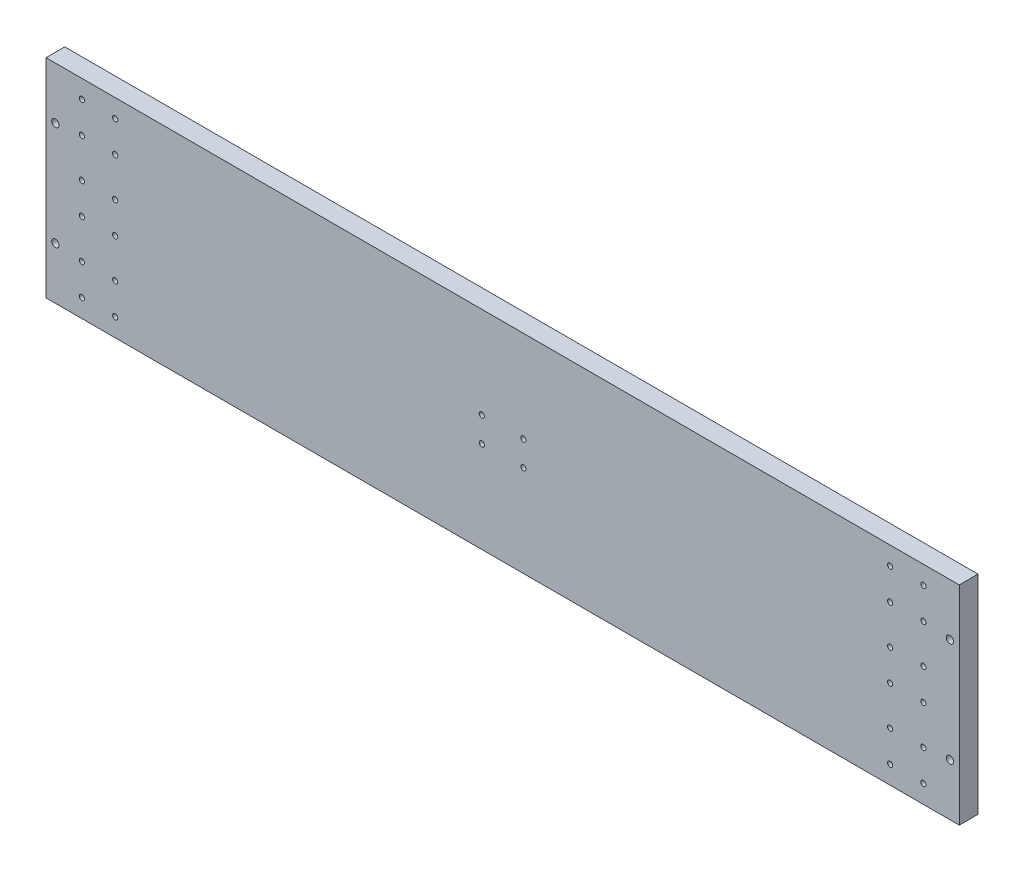
from build123d import *

# Parameters (mm, degrees)
SKETCH1_W             = 878
SKETCH1_H             = 200
BOSS_EXTRUDE1_DEPTH   = 18
OTW_R_7_0_7_1_D       = 7
OTW_R_5_0_5_1_D       = 5
OTW_R_10_0_10_1_D     = 10
OTW_R_10_0_10_1_DEPTH = 7
OTW_R_5_0_5_2_D       = 5
OTW_R_10_0_10_2_D     = 10
OTW_R_10_0_10_2_DEPTH = 7
OTW_R_8_0_8_1_D       = 8
OTW_R_8_0_8_1_DEPTH   = 15
OTW_R_8_0_8_1_TIP     = 2.403442476


with BuildPart() as part:
    # Sketch1 → Boss-Extrude1 (new body)
    with BuildSketch(Plane.XY):
        Rectangle(SKETCH1_W, SKETCH1_H)
    extrude(amount=BOSS_EXTRUDE1_DEPTH)

    # Otwór Ø7.0 (7)1 (through all)
    with Locations(Plane(origin=(0, 0, 0), x_dir=(-1, 0, 0), z_dir=(0, 0, -1))):
        with Locations((-430, 50), (-430, -50)):
            otw_r_7_0_7_1 = Hole(OTW_R_7_0_7_1_D / 2)

    # Lustro1: Otwór Ø7.0 (7)1 across plane
    add(otw_r_7_0_7_1.mirror(Plane.ZY), mode=Mode.SUBTRACT)

    # Otwór Ø5.0 (5)1 (through all)
    with Locations(Plane.XY.offset(18)):
        with Locations((372.5, 82.5), (372.5, 52.5), (404.5, 82.5), (404.5, 52.5), (404.5, 15), (404.5, -15), (372.5, 15), (372.5, -15), (372.5, -52.5), (372.5, -82.5), (404.5, -52.5), (404.5, -82.5), (-372.5, 82.5), (-372.5, 52.5), (-404.5, 52.5), (-404.5, 82.5), (-372.5, 15), (-372.5, -15), (-404.5, -15), (-404.5, 15), (-372.5, -82.5), (-372.5, -52.5), (-404.5, -52.5), (-404.5, -82.5)):
            Hole(OTW_R_5_0_5_1_D / 2)

    # Otwór Ø10.0 (10)1
    with Locations(Plane(origin=(0, 0, 0), x_dir=(-1, 0, 0), z_dir=(0, 0, -1))):
        with Locations((372.5, 82.5), (372.5, 52.5), (372.5, 15), (372.5, -15), (372.5, -52.5), (372.5, -82.5), (404.5, -82.5), (404.5, -52.5), (404.5, -15), (404.5, 15), (404.5, 52.5), (404.5, 82.5), (-372.5, -82.5), (-404.5, -82.5), (-404.5, -52.5), (-372.5, -52.5), (-372.5, -15), (-404.5, -15), (-404.5, 15), (-372.5, 15), (-372.5, 52.5), (-404.5, 52.5), (-404.5, 82.5), (-372.5, 82.5)):
            Hole(OTW_R_10_0_10_1_D / 2, depth=OTW_R_10_0_10_1_DEPTH)

    # Otwór Ø5.0 (5)2 (through all)
    with Locations(Plane.XY.offset(18)):
        with Locations((-20, 12), (20, 12), (20, -12), (-20, -12)):
            Hole(OTW_R_5_0_5_2_D / 2)

    # Otwór Ø10.0 (10)2
    with Locations(Plane(origin=(0, 0, 0), x_dir=(-1, 0, 0), z_dir=(0, 0, -1))):
        with Locations((20, 12), (20, -12), (-20, -12), (-20, 12)):
            Hole(OTW_R_10_0_10_2_D / 2, depth=OTW_R_10_0_10_2_DEPTH)

    # Otwór Ø8.0 (8)1
    with Locations(Plane(origin=(0, 0, 0), x_dir=(-1, 0, 0), z_dir=(0, 0, -1))):
        with Locations((430, 0), (-430, 0)):
            Hole(OTW_R_8_0_8_1_D / 2, depth=OTW_R_8_0_8_1_DEPTH)
            with Locations((0, 0, -(OTW_R_8_0_8_1_DEPTH + OTW_R_8_0_8_1_TIP / 2))):  # 118° drill point
                Cone(0, OTW_R_8_0_8_1_D / 2, OTW_R_8_0_8_1_TIP, mode=Mode.SUBTRACT)


solid = part.part
